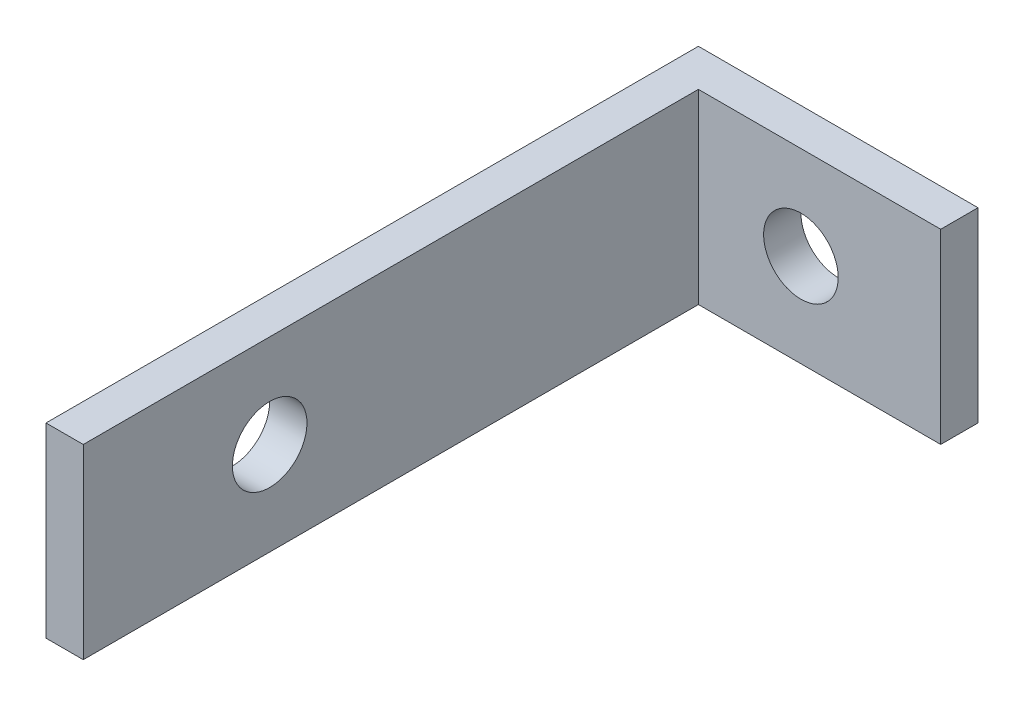
from build123d import *

# Parameters (mm, degrees)
SKETCH1_W           = 15
SKETCH1_H           = 10
BOSS_EXTRUDE2_DEPTH = 2
SKETCH2_R           = 2
CUT_EXTRUDE2_DEPTH  = 2
SKETCH3_W           = 2
SKETCH3_H           = 10
BOSS_EXTRUDE3_DEPTH = 33
SKETCH4_R           = 2
CUT_EXTRUDE3_DEPTH  = 33


with BuildPart() as part:
    # Sketch1 → Boss-Extrude2 (new body)
    with BuildSketch(Plane.XY):
        Rectangle(SKETCH1_W, SKETCH1_H)
    extrude(amount=BOSS_EXTRUDE2_DEPTH)

    # Sketch2 → Cut-Extrude2 (cut)
    with BuildSketch(Plane.XY.offset(2)):
        Circle(SKETCH2_R)
    extrude(amount=-CUT_EXTRUDE2_DEPTH, mode=Mode.SUBTRACT)

    # Sketch3 → Boss-Extrude3 (add)
    with BuildSketch(Plane.XY.offset(2)):
        with Locations((-6.5, 0)):
            Rectangle(SKETCH3_W, SKETCH3_H)
    extrude(amount=BOSS_EXTRUDE3_DEPTH)

    # Sketch4 → Cut-Extrude3 (cut)
    with BuildSketch(Plane(origin=(-5.5, 0, 0), x_dir=(0, 0, -1), z_dir=(1, 0, 0))):
        with Locations(Location((-25, 0, 0), (0, 0, 90))):
            Circle(SKETCH4_R)
    extrude(amount=-CUT_EXTRUDE3_DEPTH, mode=Mode.SUBTRACT)


solid = part.part
